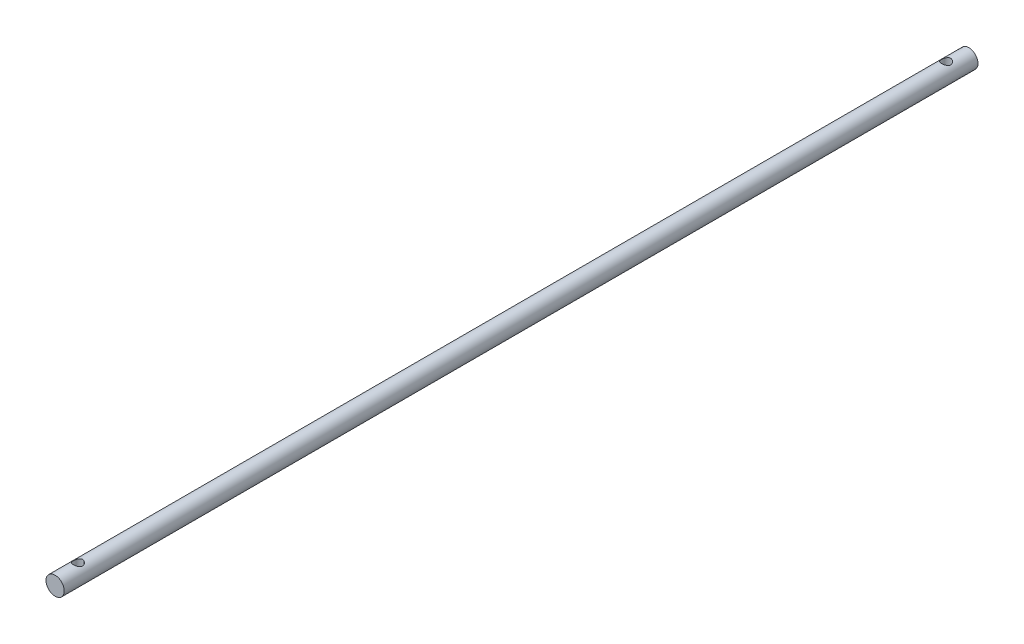
from build123d import *

# Parameters (mm, degrees)
SKETCH1_R                         = 4
EXTRUDE1_DEPTH                    = 400
SKETCH3_W                         = 2
SKETCH3_H                         = 4
F_4_0_4_DIAMETER_HOLE1_AT_2_COUNT = 2
F_4_0_4_DIAMETER_HOLE1_AT_2_PITCH = 380


with BuildPart() as part:
    # Sketch1 → Extrude1 (new body)
    with BuildSketch(Plane.XY):
        Circle(SKETCH1_R)
    extrude(amount=EXTRUDE1_DEPTH)

    # Sketch3 → Ø4.0 (4) Diameter Hole1 (revolve, cut)
    with BuildSketch(Plane(origin=(0, 0, 10), x_dir=(0, 0, -1), z_dir=(1, 0, 0))):
        with Locations((1, 2)):
            Rectangle(SKETCH3_W, SKETCH3_H)
    f_4_0_4_diameter_hole1 = revolve(axis=Axis((0, -6.35, 10), (0, 1, 0)), mode=Mode.SUBTRACT)

    # Ø4.0 (4) Diameter Hole1 at 2: Ø4.0 (4) Diameter Hole1 ×2
    with Locations(*[(0, 0, i * F_4_0_4_DIAMETER_HOLE1_AT_2_PITCH) for i in range(1, F_4_0_4_DIAMETER_HOLE1_AT_2_COUNT)]):
        add(f_4_0_4_diameter_hole1, mode=Mode.SUBTRACT)


solid = part.part
